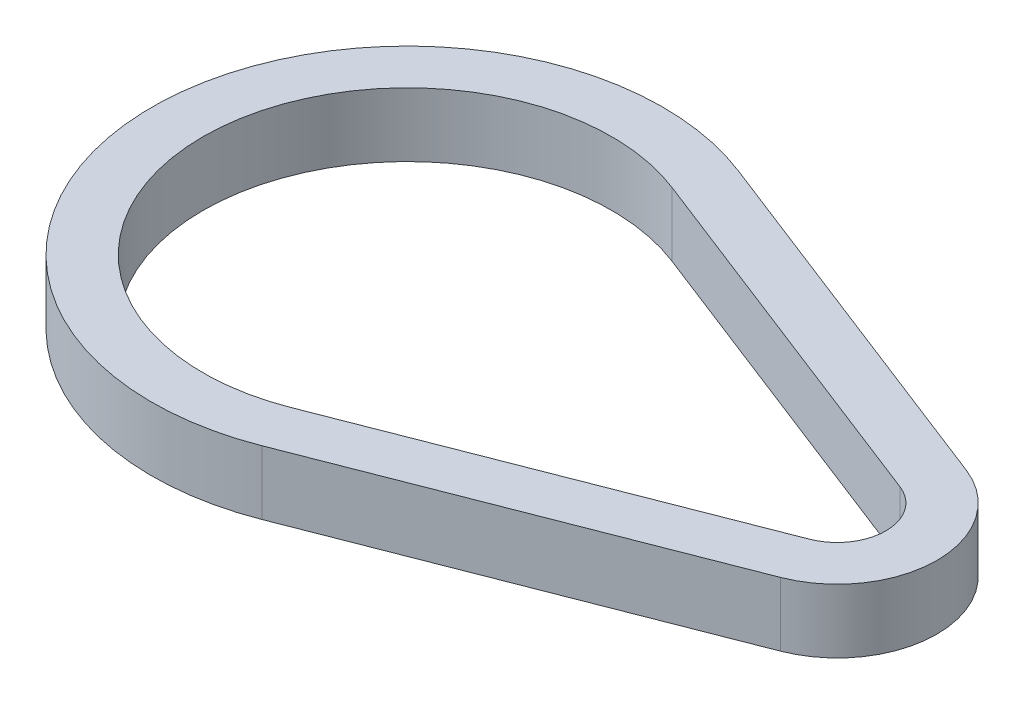
from build123d import *

# Parameters (mm, degrees)
EXTRUDE_THIN1_DEPTH = 12.5


with BuildPart() as part:
    # Sketch1 → Extrude-Thin1 (new body)
    with BuildSketch(Plane(origin=(0, 0, 0), x_dir=(1, 0, 0), z_dir=(0, 1, 0))):
        with BuildLine():
            Line((91.171938169, -18.172443164), (18.133174792, -46.596008112))
            ThreePointArc((18.133174792, -46.596008112), (-50, 0), (18.133174792, 46.596008112))
            Line((18.133174792, 46.596008112), (91.171938169, 18.172443164))
            ThreePointArc((91.171938169, 18.172443164), (103.6, 0), (91.171938169, -18.172443164))
        make_face()
        with BuildLine():
            Line((87.54530321, -8.853241541), (14.506539834, -37.27680649))
            ThreePointArc((14.506539834, -37.27680649), (-40, 0), (14.506539834, 37.27680649))
            Line((14.506539834, 37.27680649), (87.54530321, 8.853241541))
            ThreePointArc((87.54530321, 8.853241541), (93.6, 0), (87.54530321, -8.853241541))
        make_face(mode=Mode.SUBTRACT)
    extrude(amount=EXTRUDE_THIN1_DEPTH)


solid = part.part
